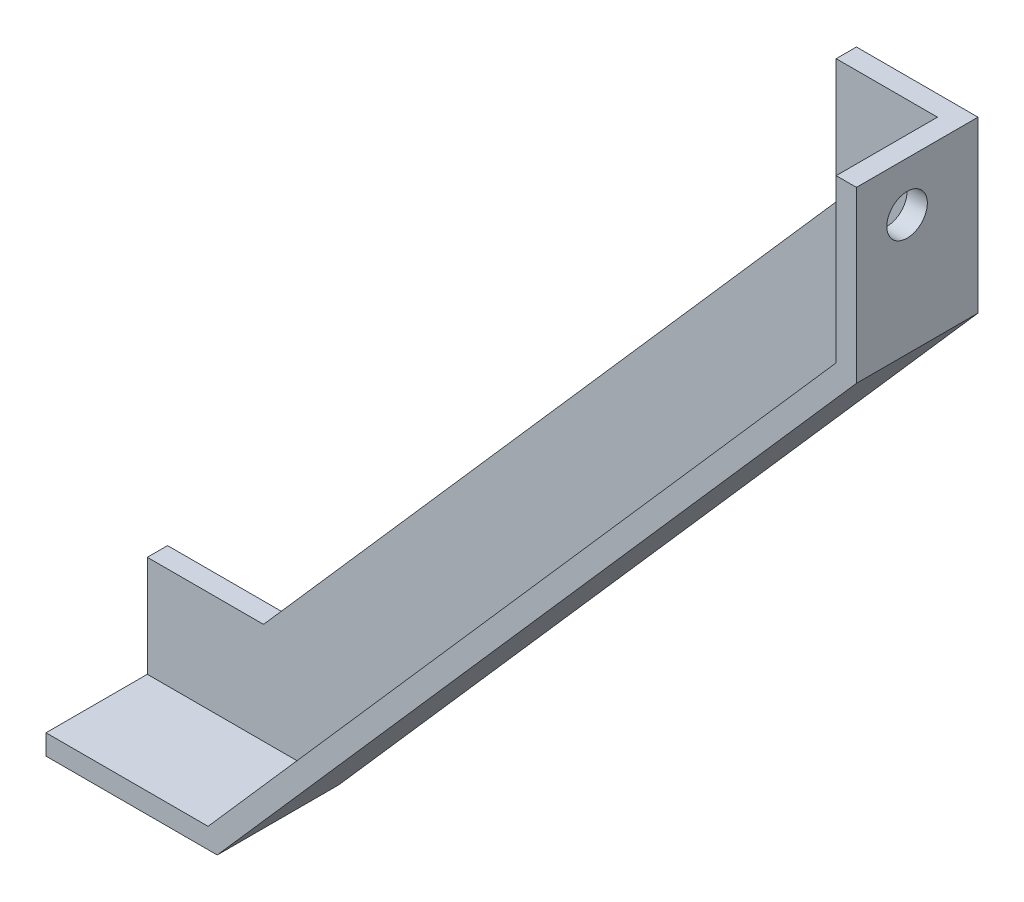
from build123d import *

# Parameters (mm, degrees)
BOSS_EXTRUDE1_DEPTH = 19.05
BOSS_EXTRUDE2_DEPTH = 3.175
SKETCH3_R           = 3.175
CUT_EXTRUDE1_DEPTH  = 189.387669682
SKETCH4_W           = 151.529186582
SKETCH4_H           = 154.937341475
CUT_EXTRUDE2_DEPTH  = 146.05


with BuildPart() as part:
    # Sketch1 → Boss-Extrude1 (new body)
    with BuildSketch(Plane.XY):
        Polygon((0, 0), (0, -26.595904174), (100.162396017, -140.692505), (127, -140.692505), (127, -137.517505), (101.6, -137.517505), (3.175, -25.4), (3.175, 0), align=None)
    boss_extrude1 = extrude(amount=BOSS_EXTRUDE1_DEPTH)

    # Sketch2 → Boss-Extrude2 (add)
    with BuildSketch(Plane(origin=(0, 0, 0), x_dir=(-1, 0, 0), z_dir=(0, 0, -1))):
        Polygon((-19.05, 0), (-3.175, 0), (-3.175, -25.4), (-101.6, -137.517505), (-127, -137.517505), (-127, -121.642505), (-108.788019913, -121.642505), (-19.05, -19.42047913), align=None)
    boss_extrude2 = extrude(amount=-BOSS_EXTRUDE2_DEPTH)

    # Sketch3 → Cut-Extrude1 (cut, through all)
    with BuildSketch(Plane(origin=(3.175, 0, 0), x_dir=(0, 0, -1), z_dir=(1, 0, 0))):
        with Locations(Location((-11.1125, -7.690689216, 0), (0, 0, 90))):
            Circle(SKETCH3_R)
    cut_extrude1 = extrude(amount=-CUT_EXTRUDE1_DEPTH, mode=Mode.SUBTRACT)

    # Mirror1: Boss-Extrude1, Boss-Extrude2, Cut-Extrude1 across plane
    add(boss_extrude1.mirror(Plane(origin=(0, 0, 19.05), x_dir=(0, 0, 1), z_dir=(1, 0, 0))))
    add(boss_extrude2.mirror(Plane(origin=(0, 0, 19.05), x_dir=(0, 0, 1), z_dir=(1, 0, 0))))
    add(cut_extrude1.mirror(Plane(origin=(0, 0, 19.05), x_dir=(0, 0, 1), z_dir=(1, 0, 0))), mode=Mode.SUBTRACT)

    # Sketch4 → Cut-Extrude2 (cut)
    with BuildSketch(Plane.XY.offset(19.05)):
        with Locations((75.764593291, -77.468670738)):
            Rectangle(SKETCH4_W, SKETCH4_H)
    extrude(amount=-CUT_EXTRUDE2_DEPTH, mode=Mode.SUBTRACT)


solid = part.part
